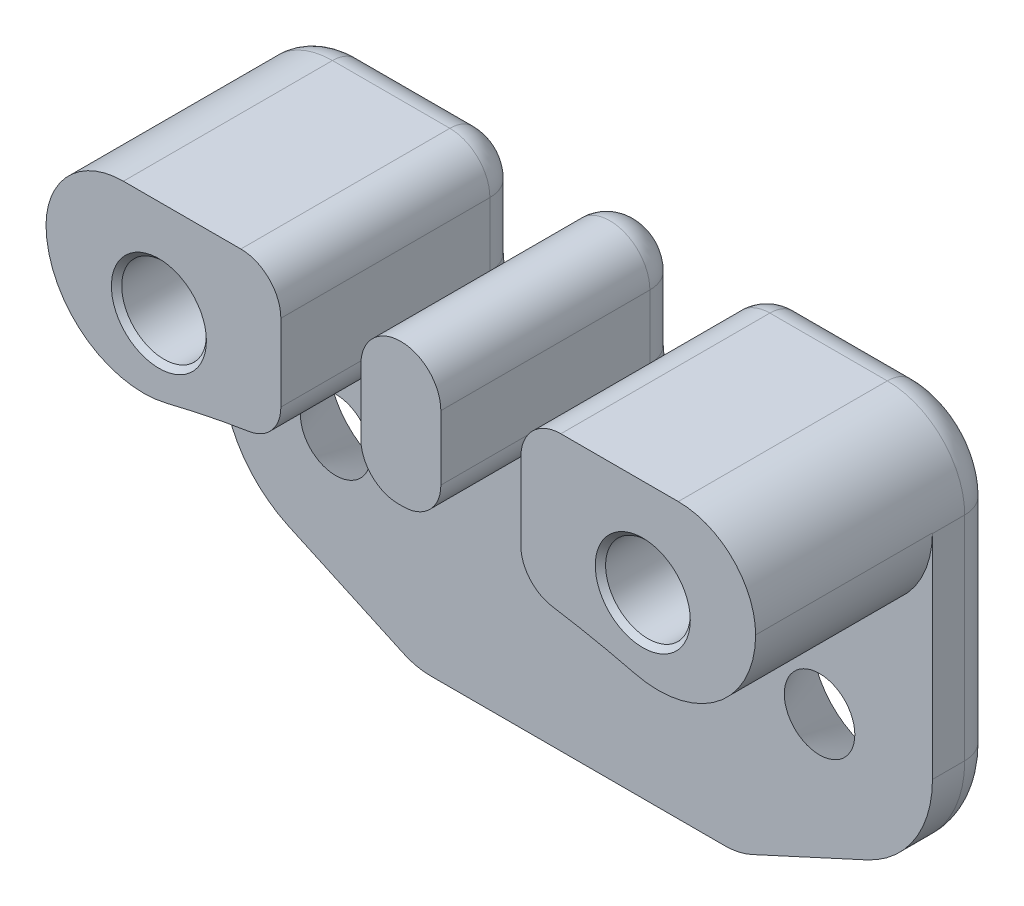
from build123d import *

# Parameters (mm, degrees)
SKETCH1_W                    = 69.85
SKETCH1_H                    = 44.45
SKETCH1_R                    = 4.1671875
BOSS_EXTRUDE1_DEPTH          = 23.749
CUT_EXTRUDE1_DEPTH           = 17.399
SKETCH3_OUTSIDE_W            = 89.076
SKETCH3_OUTSIDE_H            = 63.676
CUT_EXTRUDE2_DEPTH           = 23.749
SKETCH4_OUTSIDE_W            = 89.076
SKETCH4_OUTSIDE_H            = 63.676
CUT_EXTRUDE3_DEPTH           = 6.35
CUT_EXTRUDE4_DEPTH           = 87.132688342
SKETCH6_R                    = 7.1374
CUT_EXTRUDE6_DEPTH           = 6.35
CUT_EXTRUDE6_DRAFT           = -30
CUT_EXTRUDE6_PROFILE_2_DEPTH = 6.35
CUT_EXTRUDE6_PROFILE_2_DRAFT = -30
SKETCH7_W                    = 7.874
SKETCH7_H                    = 9.578750354
CUT_EXTRUDE7_DEPTH           = 85.602306121
FILLET2_R                    = 3.683
CHAMFER1_SIZE                = 0.508
FILLET3_R                    = 6.35
FILLET4_R                    = 3.175


with BuildPart() as part:
    # Sketch1 → Boss-Extrude1 (new body)
    with BuildSketch(Plane.XY):
        with Locations((-34.925, 22.225)):
            Rectangle(SKETCH1_W, SKETCH1_H)
        with Locations((-58.7375, 34.925)):
            Circle(SKETCH1_R, mode=Mode.SUBTRACT)
        with Locations((-11.1125, 34.925)):
            Circle(SKETCH1_R, mode=Mode.SUBTRACT)
    extrude(amount=-BOSS_EXTRUDE1_DEPTH)

    # Sketch2 → Cut-Extrude1 (cut)
    with BuildSketch(Plane.XY):
        with BuildLine():
            Line((-69.85, 36.957634205), (-69.85, 0))
            Line((-69.85, 0), (-34.925, 0))
            Line((-34.925, 0), (0, 0))
            Line((0, 0), (0, 36.957634205))
            ThreePointArc((0, 36.957634205), (-3.683397045, 29.404464031), (-11.902903765, 27.655892395))
            ThreePointArc((-11.902903765, 27.655892395), (-34.925, 30.48), (-57.947096235, 27.655892395))
            ThreePointArc((-57.947096235, 27.655892395), (-66.166602955, 29.404464031), (-69.85, 36.957634205))
        make_face()
    extrude(amount=-CUT_EXTRUDE1_DEPTH, mode=Mode.SUBTRACT)

    # Sketch3 outside → Cut-Extrude2 (cut)
    with BuildSketch(Plane.XY):
        with Locations((-34.925, 22.225)):
            Rectangle(SKETCH3_OUTSIDE_W, SKETCH3_OUTSIDE_H)
        with BuildLine():
            Line((-69.85, 36.83), (-69.85, 0))
            Line((-69.85, 0), (0, 0))
            Line((0, 0), (0, 36.83))
            ThreePointArc((0, 36.83), (-2.231846327, 42.218153673), (-7.62, 44.45))
            Line((-7.62, 44.45), (-62.23, 44.45))
            ThreePointArc((-62.23, 44.45), (-67.618153673, 42.218153673), (-69.85, 36.83))
        make_face(mode=Mode.SUBTRACT)
    extrude(amount=-CUT_EXTRUDE2_DEPTH, mode=Mode.SUBTRACT)

    # Sketch4 outside → Cut-Extrude3 (cut)
    with BuildSketch(Plane.XY.offset(-17.399)):
        with Locations((-34.925, 22.225)):
            Rectangle(SKETCH4_OUTSIDE_W, SKETCH4_OUTSIDE_H)
        with BuildLine():
            Line((-69.85, 44.45), (0, 44.45))
            Line((0, 44.45), (0, 15.875))
            ThreePointArc((0, 15.875), (-1.757438621, 9.877460267), (-6.473877678, 5.776938839))
            Line((-6.473877678, 5.776938839), (-19.05, 0))
            Line((-19.05, 0), (-50.8, 0))
            Line((-50.8, 0), (-63.376122322, 5.776938839))
            ThreePointArc((-63.376122322, 5.776938839), (-68.092561379, 9.877460267), (-69.85, 15.875))
            Line((-69.85, 15.875), (-69.85, 44.45))
        make_face(mode=Mode.SUBTRACT)
    extrude(amount=-CUT_EXTRUDE3_DEPTH, mode=Mode.SUBTRACT)

    # Sketch5 → Cut-Extrude4 (cut, through all)
    with BuildSketch(Plane.XY):
        with BuildLine():
            Line((-38.862, 34.22084733), (-38.862, 40.513))
            ThreePointArc((-38.862, 40.513), (-37.708879398, 43.296879398), (-34.925, 44.45))
            Line((-34.925, 44.45), (-50.673, 44.45))
            ThreePointArc((-50.673, 44.45), (-47.889120602, 43.296879398), (-46.736, 40.513))
            Line((-46.736, 40.513), (-46.736, 34.22084733))
            ThreePointArc((-46.736, 34.22084733), (-42.799, 30.28384733), (-38.862, 34.22084733))
        make_face()
        with BuildLine():
            Line((-19.177, 44.45), (-34.925, 44.45))
            ThreePointArc((-34.925, 44.45), (-32.141120602, 43.296879398), (-30.988, 40.513))
            Line((-30.988, 40.513), (-30.988, 34.22084733))
            ThreePointArc((-30.988, 34.22084733), (-27.051, 30.28384733), (-23.114, 34.22084733))
            Line((-23.114, 34.22084733), (-23.114, 40.513))
            ThreePointArc((-23.114, 40.513), (-21.960879398, 43.296879398), (-19.177, 44.45))
        make_face()
    extrude(amount=-CUT_EXTRUDE4_DEPTH, mode=Mode.SUBTRACT)


with BuildPart() as cut_extrude6_tool:
    # Sketch6 → Cut-Extrude6 (with draft: the straight prism first)
    with BuildSketch(Plane(origin=(0, 0, -23.749), x_dir=(-1, 0, 0), z_dir=(0, 0, -1))):
        with Locations((11.1125, 15.875)):
            Circle(SKETCH6_R)
    extrude(amount=-CUT_EXTRUDE6_DEPTH)
    # Cut-Extrude6: the draft: its side faces are tilted about the plane it starts from
    cut_extrude6_sides = [cut_extrude6_tool.faces().sort_by_distance(p)[0] for p in [
        (-3.9751, 15.875, -20.574),
    ]]
    draft(cut_extrude6_sides, Plane(origin=(0, 0, -23.749), x_dir=(-1, 0, 0), z_dir=(0, 0, -1)), CUT_EXTRUDE6_DRAFT)


with BuildPart() as part_1:
    add(part.part)

    # Cut-Extrude6: cut by cut_extrude6_tool
    add(cut_extrude6_tool.part, mode=Mode.SUBTRACT)


with BuildPart() as cut_extrude6_profile_2_tool:
    # Sketch6 → Cut-Extrude6 profile 2 (with draft: the straight prism first)
    with BuildSketch(Plane(origin=(0, 0, -23.749), x_dir=(-1, 0, 0), z_dir=(0, 0, -1))):
        with Locations((58.7375, 15.875)):
            Circle(SKETCH6_R)
    extrude(amount=-CUT_EXTRUDE6_PROFILE_2_DEPTH)
    # Cut-Extrude6 profile 2: the draft: its side faces are tilted about the plane it starts from
    cut_extrude6_profile_2_sides = [cut_extrude6_profile_2_tool.faces().sort_by_distance(p)[0] for p in [
        (-51.6001, 15.875, -20.574),
    ]]
    draft(cut_extrude6_profile_2_sides, Plane(origin=(0, 0, -23.749), x_dir=(-1, 0, 0), z_dir=(0, 0, -1)), CUT_EXTRUDE6_PROFILE_2_DRAFT)


with BuildPart() as part_2:
    add(part_1.part)

    # Cut-Extrude6 profile 2: cut by cut_extrude6_profile_2_tool
    add(cut_extrude6_profile_2_tool.part, mode=Mode.SUBTRACT)

    # Sketch7 → Cut-Extrude7 (cut, through all)
    with BuildSketch(Plane.XY.offset(-17.399)):
        with Locations((-42.799, 32.577548488)):
            Rectangle(SKETCH7_W, SKETCH7_H)
        with Locations((-27.051, 32.577548488)):
            Rectangle(SKETCH7_W, SKETCH7_H)
    extrude(amount=CUT_EXTRUDE7_DEPTH, mode=Mode.SUBTRACT)

    # Fillet2
    fillet2_edges = [part_2.edges().sort_by_distance(p)[0] for p in [
        (-38.862, 30.398600552, -8.6995),
        (-46.736, 29.744881257, -8.6995),
        (-23.114, 29.744881257, -8.6995),
        (-30.988, 30.398600552, -8.6995),
    ]]
    fillet(fillet2_edges, radius=FILLET2_R)

    # Chamfer1
    chamfer1_edges = [part_2.edges().sort_by_distance(p)[0] for p in [
        (-62.9046875, 34.925, -23.749),
        (-62.9046875, 34.925, 0),
        (-15.2796875, 34.925, -23.749),
        (-15.2796875, 34.925, 0),
    ]]
    chamfer(chamfer1_edges, length=CHAMFER1_SIZE)

    # Fillet3
    fillet3_edges = [part_2.edges().sort_by_distance(p)[0] for p in [
        (-50.8, 0, -20.574),
        (-19.05, 0, -20.574),
    ]]
    fillet(fillet3_edges, radius=FILLET3_R)

    # Fillet4
    fillet4_edges = [part_2.edges().sort_by_distance(p)[0] for p in [
        (-1.757438621, 9.877460267, -23.749),
        (-68.092561379, 9.877460267, -23.749),
        (-12.130971605, 3.178309088, -23.749),
        (-56.4515, 44.45, -23.749),
        (-42.799, 30.28384733, -23.749),
        (-47.889120602, 43.296879398, -23.749),
        (-34.925, 44.45, -23.749),
        (-38.862, 37.366923665, -23.749),
        (-46.736, 37.366923665, -23.749),
        (-23.114, 37.366923665, -23.749),
        (-27.051, 30.28384733, -23.749),
        (-21.960879398, 43.296879398, -23.749),
        (-30.988, 37.366923665, -23.749),
        (-57.719028395, 3.178309088, -23.749),
        (-34.925, 0, -23.749),
        (-19.082063244, 0.146612369, -23.749),
        (-50.767936756, 0.146612369, -23.749),
        (-69.85, 26.3525, -23.749),
        (-13.3985, 44.45, -23.749),
        (-2.231846327, 42.218153673, -23.749),
        (-67.618153673, 42.218153673, -23.749),
        (0, 26.3525, -23.749),
    ]]
    fillet(fillet4_edges, radius=FILLET4_R)


solid = part_2.part
